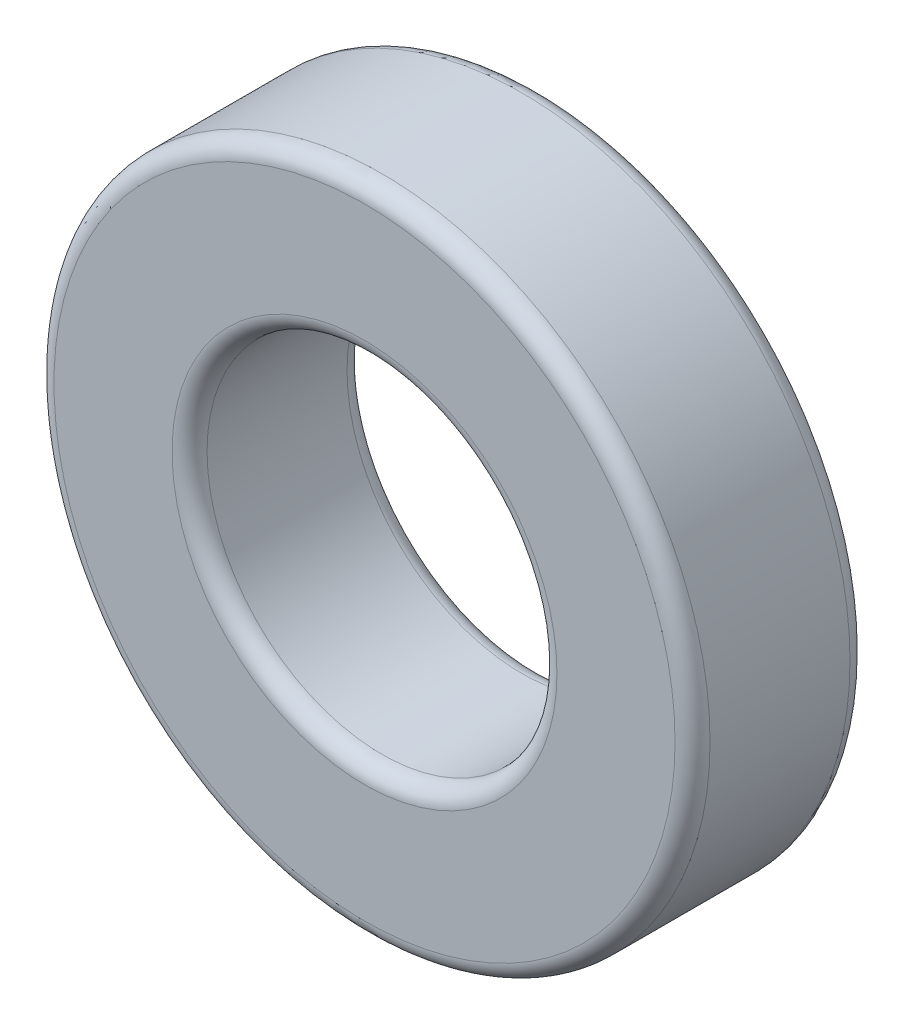
from build123d import *

# Parameters (mm, degrees)
SKETCH1_R           = 0.9375
SKETCH1_R_2         = 0.5
BOSS_EXTRUDE1_DEPTH = 0.5
FILLET1_R           = 0.05


with BuildPart() as part:
    # Sketch1 → Boss-Extrude1 (new body)
    with BuildSketch(Plane.XY):
        Circle(SKETCH1_R)
        Circle(SKETCH1_R_2, mode=Mode.SUBTRACT)
    extrude(amount=BOSS_EXTRUDE1_DEPTH)

    # Fillet1
    fillet1_edges = [part.edges().sort_by_distance(p)[0] for p in [
        (-0.9375, 0, 0),
        (-0.9375, 0, 0.5),
        (-0.5, 0, 0),
        (-0.5, 0, 0.5),
    ]]
    fillet(fillet1_edges, radius=FILLET1_R)


solid = part.part
